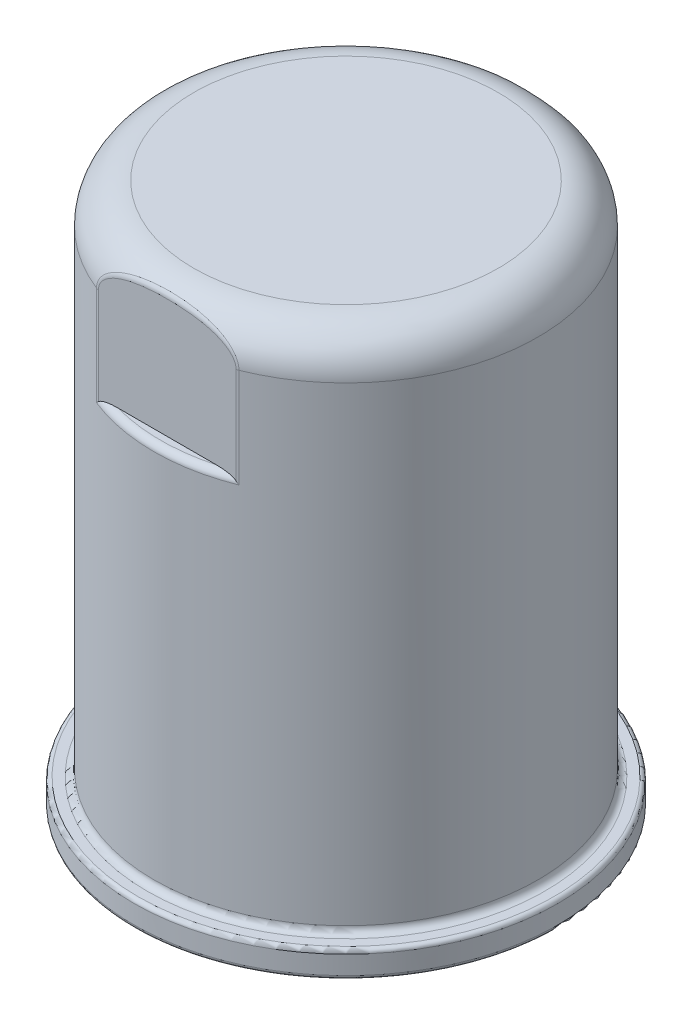
from build123d import *

# Parameters (mm, degrees)
PERFORADOR_PARA_ROSCAR_HELICOIL_DE_M121_D     = 10.25
PERFORADOR_PARA_ROSCAR_HELICOIL_DE_M121_DEPTH = 10
PERFORADOR_PARA_ROSCAR_HELICOIL_DE_M121_TIP   = 3.079410673
REDONDEO1_R                                   = 1
REDONDEO2_R                                   = 0.3
REDONDEO3_R                                   = 0.5
REDONDEO4_R                                   = 3
CORTAR_EXTRUIR1_START                         = -10
CORTAR_EXTRUIR1_DEPTH                         = 10
REDONDEO5_R                                   = 0.5


with BuildPart() as part:
    # Croquis1 → Revolución1 (revolve)
    with BuildSketch(Plane.XY, mode=Mode.PRIVATE) as revoluci_n1_sk:
        Polygon((0, 41), (14.5, 41), (14.5, 2), (16, 2), (16, 0), (14.5, 0), (11.5, 0), (11.5, 21), (0, 21), align=None)
    revolve(revoluci_n1_sk.sketch.rotate(Axis((0, 0, 0), (0, 1, 0)), 90), axis=Axis((0, 0, 0), (0, 1, 0)))

    # Perforador para roscar Helicoil de M121
    with Locations(Plane(origin=(0, 21, 0), x_dir=(-1, 0, 0), z_dir=(0, -1, 0))):
        with Locations((0, 0)):
            Hole(PERFORADOR_PARA_ROSCAR_HELICOIL_DE_M121_D / 2, depth=PERFORADOR_PARA_ROSCAR_HELICOIL_DE_M121_DEPTH)
            with Locations((0, 0, -(PERFORADOR_PARA_ROSCAR_HELICOIL_DE_M121_DEPTH + PERFORADOR_PARA_ROSCAR_HELICOIL_DE_M121_TIP / 2))):  # 118° drill point
                Cone(0, PERFORADOR_PARA_ROSCAR_HELICOIL_DE_M121_D / 2, PERFORADOR_PARA_ROSCAR_HELICOIL_DE_M121_TIP, mode=Mode.SUBTRACT)

    # Redondeo1
    redondeo1_edges = [part.edges().sort_by_distance(p)[0] for p in [
        (0, 0, 11.5),
    ]]
    fillet(redondeo1_edges, radius=REDONDEO1_R)

    # Redondeo2
    redondeo2_edges = [part.edges().sort_by_distance(p)[0] for p in [
        (0, 0, 16),
        (0, 2, 16),
    ]]
    fillet(redondeo2_edges, radius=REDONDEO2_R)

    # Redondeo3
    redondeo3_edges = [part.edges().sort_by_distance(p)[0] for p in [
        (0, 2, 14.5),
    ]]
    fillet(redondeo3_edges, radius=REDONDEO3_R)

    # Redondeo4
    redondeo4_edges = [part.edges().sort_by_distance(p)[0] for p in [
        (0, 41, 14.5),
    ]]
    fillet(redondeo4_edges, radius=REDONDEO4_R)

    # Croquis5 → Cortar-Extruir1 (cut)
    with BuildSketch(Plane(origin=(0, 41, 0), x_dir=(1, 0, 0), z_dir=(0, 1, 0)).offset(CORTAR_EXTRUIR1_START)):
        with BuildLine():
            Line((-5.291502622, 13.5), (5.291502622, 13.5))
            ThreePointArc((5.291502622, 13.5), (0, 14.5), (-5.291502622, 13.5))
        make_face()
        with BuildLine():
            Line((-5.291502622, -13.5), (5.291502622, -13.5))
            ThreePointArc((5.291502622, -13.5), (0, -14.5), (-5.291502622, -13.5))
        make_face()
    extrude(amount=CORTAR_EXTRUIR1_DEPTH, mode=Mode.SUBTRACT)

    # Redondeo5
    redondeo5_edges = [part.edges().sort_by_distance(p)[0] for p in [
        (5.291502622, 34.5, 13.5),
        (-5.291502622, 34.5, -13.5),
        (-5.291502622, 34.5, -13.5),
        (-2.692582404, 31, -14.247806849),
        (5.291502622, 34.5, -13.5),
        (5.291502622, 34.5, 13.5),
        (0, 31, 14.5),
        (-5.291502622, 34.5, 13.5),
    ]]
    fillet(redondeo5_edges, radius=REDONDEO5_R)


solid = part.part
